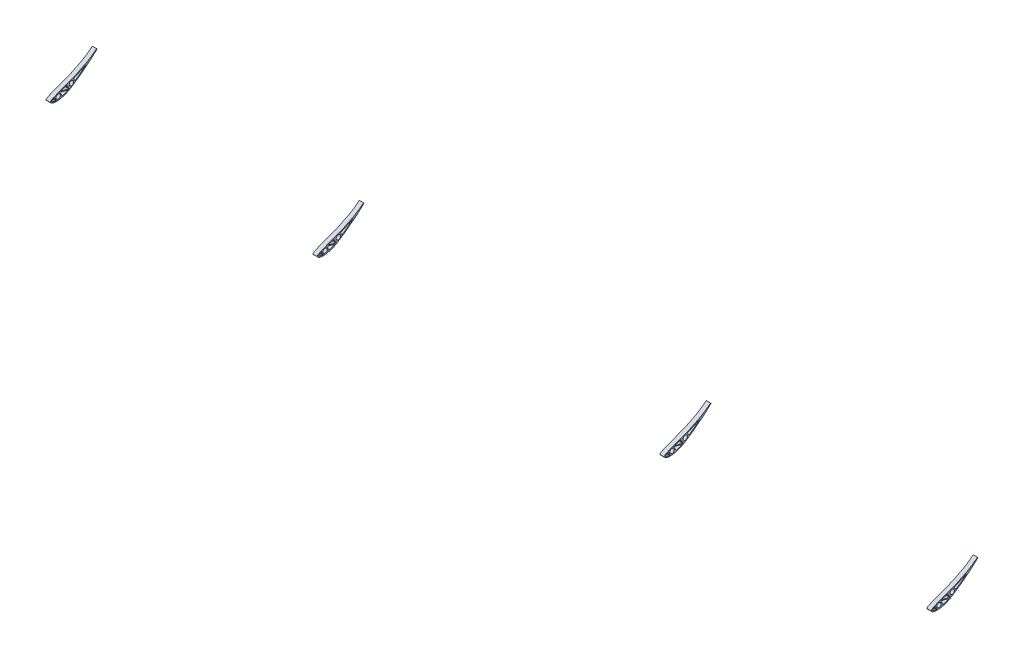
from build123d import *

# Parameters (mm, degrees)
SKETCH2_R           = 3.2639
BOSS_EXTRUDE1_DEPTH = 6.35


with BuildPart() as part:
    # Sketch2 → Boss-Extrude1 (new body)
    with BuildSketch(Plane.ZY.offset(663.1865959)):
        with BuildLine():
            Line((1136.630504188, 182.133707597), (1135.893994797, 181.26702091))
            add(Edge.make_bspline(
                [(1136.630504188, 182.133707597), (1137.066119731, 181.76352199), (1138.375116861, 180.679747984), (1140.679116166, 178.899421574), (1143.62744, 176.796992986), (1146.825009555, 174.687104599), (1150.233474254, 172.595300148), (1153.814439078, 170.546629142), (1157.527449827, 168.563077313), (1161.329152018, 166.660841179), (1165.176114355, 164.853367771), (1169.026852932, 163.153813452), (1172.836924367, 161.564269346), (1176.566730895, 160.089796876), (1180.175854205, 158.728781622), (1183.6282507, 157.477861297), (1186.888838836, 156.329388397), (1189.925915113, 155.271152181), (1192.718476384, 154.297667439), (1195.247426438, 153.346856261), (1197.517251541, 152.40054328), (1199.554992716, 151.507909873), (1201.353962227, 150.678931413), (1202.8946192, 149.920130777), (1204.168758712, 149.255426553), (1205.137213739, 148.649468063), (1205.839108171, 148.196057213), (1206.228826291, 147.629814428), (1206.075792706, 147.031181956), (1205.775826139, 146.455393129), (1205.265024828, 145.864815207), (1204.582557436, 145.299536969), (1203.728478788, 144.782328959), (1202.714927511, 144.329077319), (1201.532940335, 143.977009559), (1200.189890585, 143.730828694), (1198.693999846, 143.574626048), (1197.055073413, 143.524367662), (1195.286533958, 143.585811331), (1193.400470735, 143.762893771), (1191.409691457, 144.066745056), (1189.326253016, 144.494933513), (1187.165444407, 145.05676343), (1184.940418299, 145.756797678), (1182.667266934, 146.618211374), (1180.344960767, 147.640380109), (1177.977421187, 148.850612636), (1175.558256699, 150.239903404), (1173.065716925, 151.760208049), (1170.520006398, 153.41660688), (1167.926544305, 155.184752775), (1165.294570454, 157.044896923), (1162.635355534, 158.971425704), (1159.968778122, 160.945553623), (1157.313730844, 162.945429688), (1154.694480313, 164.960330292), (1152.130876047, 166.977181509), (1149.638996042, 168.982449144), (1147.237017664, 170.966734271), (1144.936945835, 172.915420541), (1142.75457142, 174.818498495), (1140.700852346, 176.661735349), (1138.788604236, 178.434350798), (1137.200875365, 179.960557543), (1136.257162963, 180.899859047), (1135.893994797, 181.26702091)],
                knots=[0.064132857, 0.064132857, 0.064132857, 0.064132857, 0.073341232, 0.091507989, 0.111021837, 0.131661709, 0.153207715, 0.175433402, 0.198110317, 0.221011446, 0.243905882, 0.266573311, 0.288810349, 0.310405036, 0.331177743, 0.350943876, 0.3695564, 0.386864963, 0.402753039, 0.417195876, 0.430379519, 0.442362633, 0.453032156, 0.462284346, 0.470026206, 0.476176645, 0.480649947, 0.483553073, 0.486420689, 0.489953231, 0.494096927, 0.498850588, 0.50419675, 0.510125492, 0.516691031, 0.524011699, 0.532092122, 0.540897921, 0.550403414, 0.560581041, 0.571396483, 0.582828081, 0.594829641, 0.607347037, 0.620384325, 0.633968937, 0.648199967, 0.663193937, 0.678898581, 0.695226562, 0.712113221, 0.729459406, 0.747143117, 0.765009772, 0.782904928, 0.800688045, 0.818242105, 0.835449083, 0.852211621, 0.868429578, 0.884009363, 0.898854951, 0.912881827, 0.92601075, 0.934329716, 0.934329716, 0.934329716, 0.934329716], degree=3))
        make_face()
        with BuildLine():
            ThreePointArc((1180.043568782, 149.499448411), (1179.885727756, 149.750616713), (1180.07366367, 149.98013664))
            Line((1180.07366367, 149.98013664), (1191.137547775, 152.936369982))
            ThreePointArc((1191.137547775, 152.936369982), (1191.40473579, 152.845462579), (1191.422996728, 152.563824284))
            Line((1191.422996728, 152.563824284), (1187.932802562, 146.528422224))
            ThreePointArc((1187.932802562, 146.528422224), (1187.795269791, 146.415296128), (1187.617258721, 146.420279693))
            Line((1187.617258721, 146.420279693), (1180.043568782, 149.499448411))
        make_face(mode=Mode.SUBTRACT)
        with BuildLine():
            Line((1197.46642821, 144.877290966), (1199.799951636, 150.249256352))
            ThreePointArc((1199.799951636, 150.249256352), (1199.973441392, 150.394994629), (1200.19426175, 150.344233321))
            Line((1200.19426175, 150.344233321), (1204.314389048, 146.955726762))
            ThreePointArc((1204.314389048, 146.955726762), (1204.402232095, 146.710322381), (1204.227667684, 146.516758495))
            Line((1204.227667684, 146.516758495), (1197.77401696, 144.533299668))
            ThreePointArc((1197.77401696, 144.533299668), (1197.510053453, 144.606784727), (1197.46642821, 144.877290966))
        make_face(mode=Mode.SUBTRACT)
        with Locations(Location((1194.282457063, 148.838104533, 0), (0, 0, 180))):
            Circle(SKETCH2_R, mode=Mode.SUBTRACT)
        with Locations(Location((1174.397734647, 156.224528624, 0), (0, 0, 180))):
            Circle(SKETCH2_R, mode=Mode.SUBTRACT)
        with BuildLine():
            ThreePointArc((1178.110615591, 150.649430522), (1177.843261646, 150.744486149), (1177.830811608, 151.027962251))
            Line((1177.830811608, 151.027962251), (1181.412472248, 156.886090304))
            ThreePointArc((1181.412472248, 156.886090304), (1181.546333972, 156.993706522), (1181.718076455, 156.991531376))
            Line((1181.718076455, 156.991531376), (1189.557655338, 154.06246735))
            ThreePointArc((1189.557655338, 154.06246735), (1189.722396687, 153.811011017), (1189.531855114, 153.578494548))
            Line((1189.531855114, 153.578494548), (1178.110615591, 150.649430522))
        make_face(mode=Mode.SUBTRACT)
        with BuildLine():
            Line((1171.265611372, 160.201726733), (1168.954245262, 157.064872727))
            ThreePointArc((1168.954245262, 157.064872727), (1168.787811646, 156.964411545), (1168.599088524, 157.0110611))
            Line((1168.599088524, 157.0110611), (1152.854303811, 168.612481415))
            ThreePointArc((1152.854303811, 168.612481415), (1152.786688766, 168.946836779), (1153.112791603, 169.046947933))
            Line((1153.112791603, 169.046947933), (1171.175604036, 160.579139341))
            ThreePointArc((1171.175604036, 160.579139341), (1171.308198239, 160.411322087), (1171.265611372, 160.201726733))
        make_face(mode=Mode.SUBTRACT)
    extrude(amount=-BOSS_EXTRUDE1_DEPTH)


with BuildPart() as body_2:
    # Mirror1: mirrored copy
    add(part.part.mirror(Plane(origin=(-459.9865959, 0, 0), x_dir=(0, 0, 1), z_dir=(1, 0, 0))))


with BuildPart() as body_3:
    # Mirror3: mirrored copy
    add(body_2.part.mirror(Plane(origin=(0, 0, 0), x_dir=(0, 0, 1), z_dir=(1, 0, 0))))


with BuildPart() as body_4:
    # Mirror4: mirrored copy
    add(body_3.part.mirror(Plane(origin=(459.9865959, 0, 0), x_dir=(0, 0, 1), z_dir=(1, 0, 0))))


solid = Compound([part.part, body_2.part, body_3.part, body_4.part])
